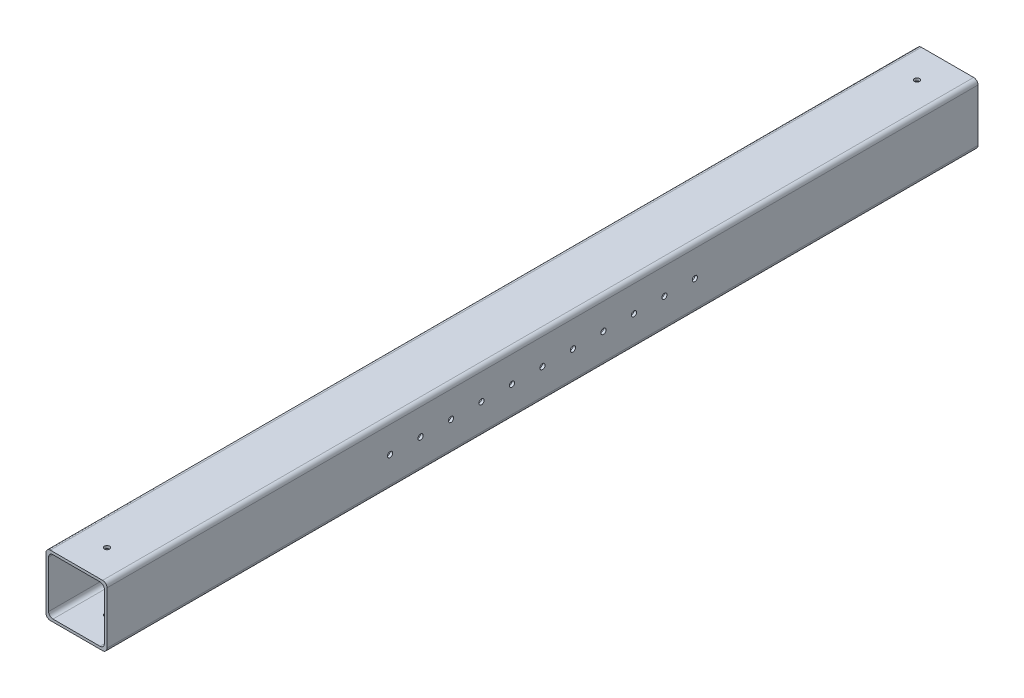
from build123d import *

# Parameters (mm, degrees)
SKETCH1_W           = 70
SKETCH1_H           = 70
SKETCH1_W_2         = 64
SKETCH1_H_2         = 64
BOSS_EXTRUDE1_DEPTH = 1000
FILLET1_R           = 5
SKETCH2_R           = 3
CUT_EXTRUDE1_DEPTH  = 70
SKETCH3_R           = 3
CUT_EXTRUDE2_DEPTH  = 70
LPATTERN1_COUNT     = 6
LPATTERN1_PITCH     = 35
LPATTERN1_COL_COUNT = 6
LPATTERN1_COL_PITCH = 35


with BuildPart() as part:
    # Sketch1 → Boss-Extrude1 (new body)
    with BuildSketch(Plane.XY):
        with Locations((35, 35)):
            Rectangle(SKETCH1_W, SKETCH1_H)
        with Locations((35, 35)):
            Rectangle(SKETCH1_W_2, SKETCH1_H_2, mode=Mode.SUBTRACT)
    extrude(amount=BOSS_EXTRUDE1_DEPTH)

    # Fillet1
    fillet1_edges = [part.edges().sort_by_distance(p)[0] for p in [
        (3, 67, 500),
        (3, 3, 500),
        (67, 3, 500),
        (67, 67, 500),
        (0, 70, 500),
        (70, 70, 500),
        (70, 0, 500),
        (0, 0, 500),
    ]]
    fillet(fillet1_edges, radius=FILLET1_R)

    # Sketch2 → Cut-Extrude1 (cut)
    with BuildSketch(Plane(origin=(0, 70, 0), x_dir=(1, 0, 0), z_dir=(0, 1, 0))):
        with Locations(Location((35, -965, 0), (0, 0, 270))):
            Circle(SKETCH2_R)
        with Locations(Location((35, -35, 0), (0, 0, 270))):
            Circle(SKETCH2_R)
    extrude(amount=-CUT_EXTRUDE1_DEPTH, mode=Mode.SUBTRACT)

    # Sketch3 → Cut-Extrude2 (cut)
    with BuildSketch(Plane(origin=(70, 0, 0), x_dir=(0, 0, -1), z_dir=(1, 0, 0))):
        with Locations((-500, 35)):
            Circle(SKETCH3_R)
    cut_extrude2 = extrude(amount=-CUT_EXTRUDE2_DEPTH, mode=Mode.SUBTRACT)

    # LPattern1: Cut-Extrude2 ×6
    with Locations(*[(0, 0, -i * LPATTERN1_PITCH) for i in range(1, LPATTERN1_COUNT)]):
        add(cut_extrude2, mode=Mode.SUBTRACT)

    # LPattern1 col: Cut-Extrude2 ×6
    with Locations(*[(0, 0, i * LPATTERN1_COL_PITCH) for i in range(1, LPATTERN1_COL_COUNT)]):
        add(cut_extrude2, mode=Mode.SUBTRACT)


solid = part.part
